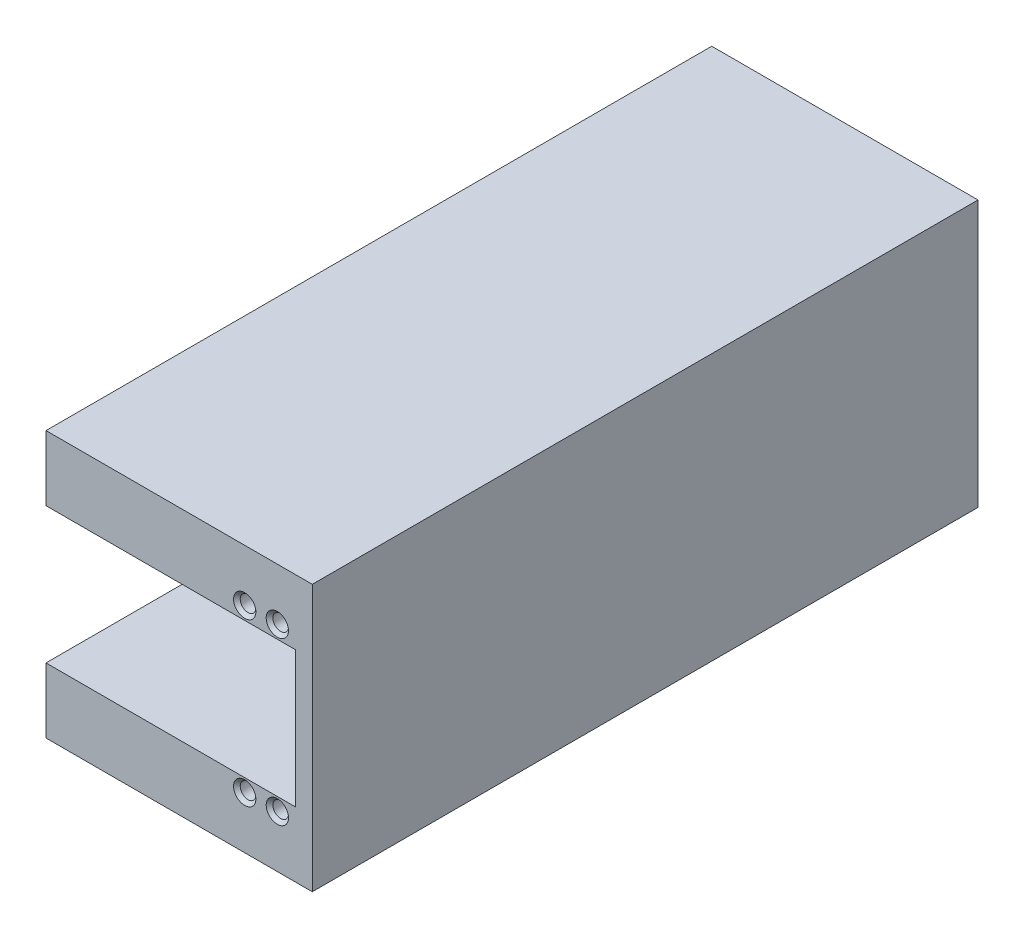
from build123d import *

# Parameters (mm, degrees)
BOSS_EXTRUDE1_DEPTH = 200
SKETCH2_R           = 2.35
CUT_EXTRUDE1_DEPTH  = 8
CUT_EXTRUDE2_START  = -8
SKETCH3_R           = 2.35
CUT_EXTRUDE2_DEPTH  = 8
CHAMFER1_SIZE       = 1


with BuildPart() as part:
    # Sketch1 → Boss-Extrude1 (new body)
    with BuildSketch(Plane.XY):
        Polygon((-40, 40), (40, 40), (40, -40), (-40, -40), (-40, -20.45), (35, -20.45), (35, 20.45), (-40, 20.45), align=None)
    extrude(amount=BOSS_EXTRUDE1_DEPTH)

    # Sketch2 → Cut-Extrude1 (cut)
    with BuildSketch(Plane.XY.offset(200)):
        with Locations((29.5, 24.34)):
            Circle(SKETCH2_R)
        with Locations(Location((19.7, 24.34, 0), (0, 0, 180))):
            Circle(SKETCH2_R)
        with Locations((19.7, -24.34)):
            Circle(SKETCH2_R)
        with Locations(Location((29.5, -24.34, 0), (0, 0, 180))):
            Circle(SKETCH2_R)
    extrude(amount=-CUT_EXTRUDE1_DEPTH, mode=Mode.SUBTRACT)

    # Sketch3 → Cut-Extrude2 (cut)
    with BuildSketch(Plane(origin=(0, 0, 0), x_dir=(-1, 0, 0), z_dir=(0, 0, -1)).offset(CUT_EXTRUDE2_START)):
        with Locations(Location((-29.5, 24.34, 0), (0, 0, 180))):
            Circle(SKETCH3_R)
        with Locations((-19.7, 24.34)):
            Circle(SKETCH3_R)
        with Locations(Location((-19.7, -24.34, 0), (0, 0, 180))):
            Circle(SKETCH3_R)
        with Locations((-29.5, -24.34)):
            Circle(SKETCH3_R)
    extrude(amount=CUT_EXTRUDE2_DEPTH, mode=Mode.SUBTRACT)

    # Chamfer1
    chamfer1_edges = [part.edges().sort_by_distance(p)[0] for p in [
        (31.85, -24.34, 200),
        (17.35, -24.34, 200),
        (22.05, 24.34, 200),
        (27.15, 24.34, 200),
        (31.85, -24.34, 0),
        (17.35, -24.34, 0),
        (22.05, 24.34, 0),
        (27.15, 24.34, 0),
    ]]
    chamfer(chamfer1_edges, length=CHAMFER1_SIZE)


solid = part.part
